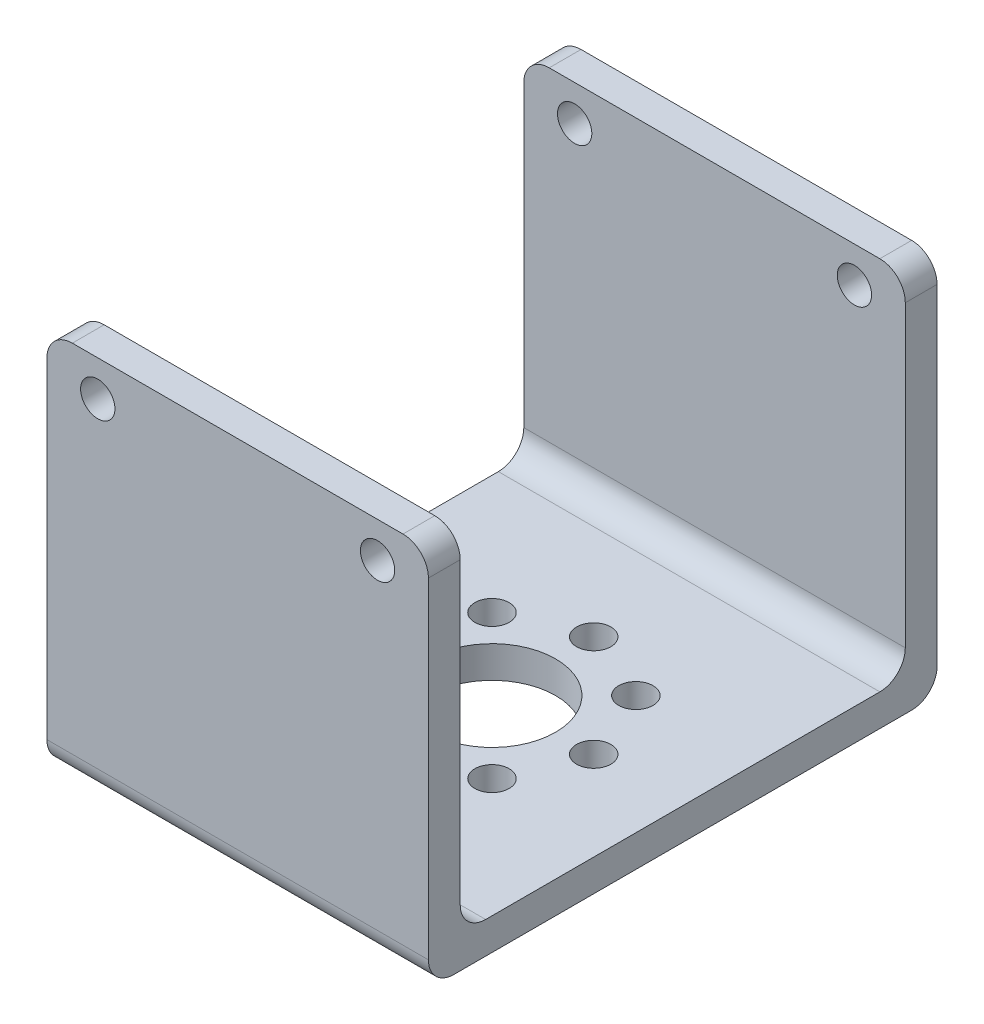
from build123d import *

# Parameters (mm, degrees)
ESBO_O1_W                = 30
ESBO_O1_H                = 30
RESSALTO_EXTRUS_O1_DEPTH = 40
ESBO_O2_W                = 35
ESBO_O2_H                = 27.5
CORTE_EXTRUS_O1_DEPTH    = 40
FILETE1_R                = 2
FILETE2_R                = 2
ESBO_O4_R                = 5
CORTE_EXTRUS_O3_DEPTH    = 53.201532545
ESBO_O5_R                = 1.35
CORTE_EXTRUS_O5_DEPTH    = 53.201532545
ESBO_O7_R                = 1.35
CORTE_EXTRUS_O6_DEPTH    = 46.276925691


with BuildPart() as part:
    # Esboço1 → Ressalto-extrusão1 (new body)
    with BuildSketch(Plane.XY):
        Rectangle(ESBO_O1_W, ESBO_O1_H)
    extrude(amount=RESSALTO_EXTRUS_O1_DEPTH)

    # Esboço2 → Corte-extrusão1 (cut)
    with BuildSketch(Plane(origin=(15, 0, 0), x_dir=(0, 0, -1), z_dir=(1, 0, 0))):
        with Locations((-20, 1.25)):
            Rectangle(ESBO_O2_W, ESBO_O2_H)
    extrude(amount=-CORTE_EXTRUS_O1_DEPTH, mode=Mode.SUBTRACT)

    # Filete1
    filete1_edges = [part.edges().sort_by_distance(p)[0] for p in [
        (-15, 15, 1.25),
        (15, 15, 1.25),
        (-15, 15, 38.75),
        (15, 15, 38.75),
    ]]
    fillet(filete1_edges, radius=FILETE1_R)

    # Filete2
    filete2_edges = [part.edges().sort_by_distance(p)[0] for p in [
        (0, -15, 40),
        (0, -12.5, 2.5),
        (0, -12.5, 37.5),
        (0, -15, 0),
    ]]
    fillet(filete2_edges, radius=FILETE2_R)

    # Esboço4 → Corte-extrusão3 (cut, through all)
    with BuildSketch(Plane(origin=(0, -15, 0), x_dir=(-1, 0, 0), z_dir=(0, -1, 0))):
        with Locations(Location((0, -20, 0), (0, 0, 90))):
            Circle(ESBO_O4_R)
    extrude(amount=-CORTE_EXTRUS_O3_DEPTH, mode=Mode.SUBTRACT)

    # Esboço5 → Corte-extrusão5 (cut, through all)
    with BuildSketch(Plane(origin=(0, -15, 0), x_dir=(-1, 0, 0), z_dir=(0, -1, 0))):
        with Locations(Location((0, -28, 0), (0, 0, 90))):
            Circle(ESBO_O5_R)
        with Locations(Location((-5.656854249, -25.656854249, 0), (0, 0, 90))):
            Circle(ESBO_O5_R)
        with Locations(Location((-8, -20, 0), (0, 0, 90))):
            Circle(ESBO_O5_R)
        with Locations(Location((-5.656854251, -14.343145752, 0), (0, 0, 90))):
            Circle(ESBO_O5_R)
        with Locations(Location((0, -12, 0), (0, 0, 90))):
            Circle(ESBO_O5_R)
        with Locations(Location((5.656854251, -14.343145752, 0), (0, 0, 90))):
            Circle(ESBO_O5_R)
        with Locations(Location((8, -20, 0), (0, 0, 90))):
            Circle(ESBO_O5_R)
        with Locations(Location((5.656854249, -25.656854249, 0), (0, 0, 90))):
            Circle(ESBO_O5_R)
    extrude(amount=-CORTE_EXTRUS_O5_DEPTH, mode=Mode.SUBTRACT)

    # Esboço7 → Corte-extrusão6 (cut, through all)
    with BuildSketch(Plane(origin=(0, 0, 0), x_dir=(-1, 0, 0), z_dir=(0, 0, -1))):
        with Locations((-11, 12.2)):
            Circle(ESBO_O7_R)
        with Locations((11, 12.2)):
            Circle(ESBO_O7_R)
    extrude(amount=-CORTE_EXTRUS_O6_DEPTH, mode=Mode.SUBTRACT)


solid = part.part
